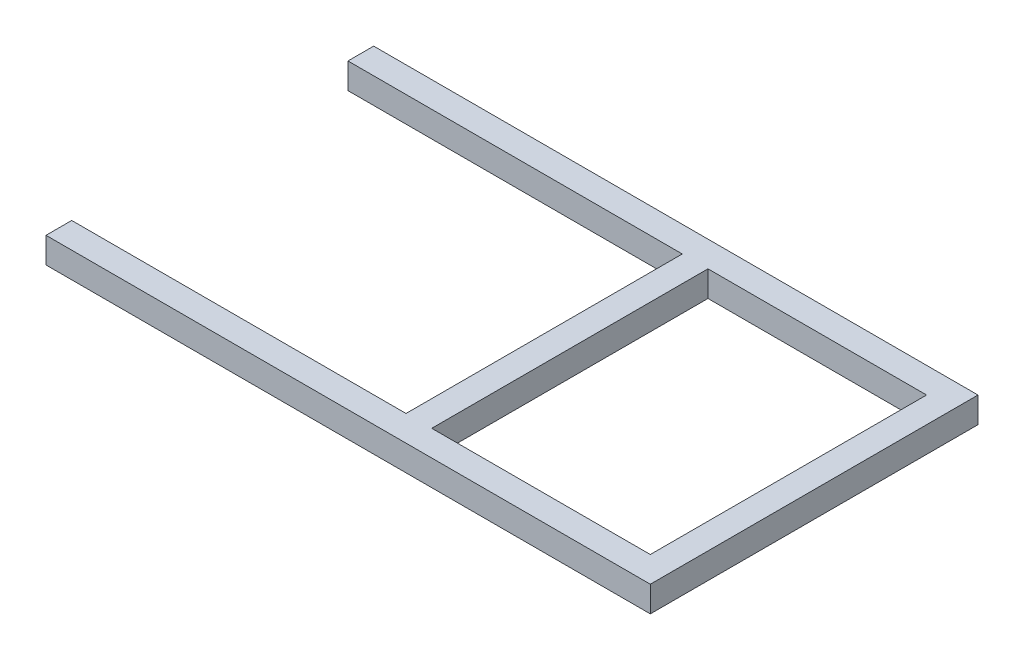
from build123d import *

# Parameters (mm, degrees)
SKETCH1_W           = 20
SKETCH1_H           = 254.85
BOSS_EXTRUDE1_DEPTH = 20
SKETCH3_W           = 20
SKETCH3_H           = 20
BOSS_EXTRUDE2_DEPTH = 450
SKETCH5_W           = 20
SKETCH5_H           = 20
BOSS_EXTRUDE4_DEPTH = 214.85


with BuildPart() as part:
    # Sketch1 → Boss-Extrude1 (new body)
    with BuildSketch(Plane(origin=(0, 0, 0), x_dir=(1, 0, 0), z_dir=(0, 1, 0))):
        Rectangle(SKETCH1_W, SKETCH1_H)
    extrude(amount=BOSS_EXTRUDE1_DEPTH)

    # Sketch3 → Boss-Extrude2 (add)
    with BuildSketch(Plane.ZY.offset(10)):
        with Locations((117.425, 10)):
            Rectangle(SKETCH3_W, SKETCH3_H)
        with Locations((-117.425, 10)):
            Rectangle(SKETCH3_W, SKETCH3_H)
    extrude(amount=BOSS_EXTRUDE2_DEPTH)

    # Sketch5 → Boss-Extrude4 (add)
    with BuildSketch(Plane.XY.offset(-107.425)):
        with Locations((-190, 10)):
            Rectangle(SKETCH5_W, SKETCH5_H)
    extrude(amount=BOSS_EXTRUDE4_DEPTH)


solid = part.part
